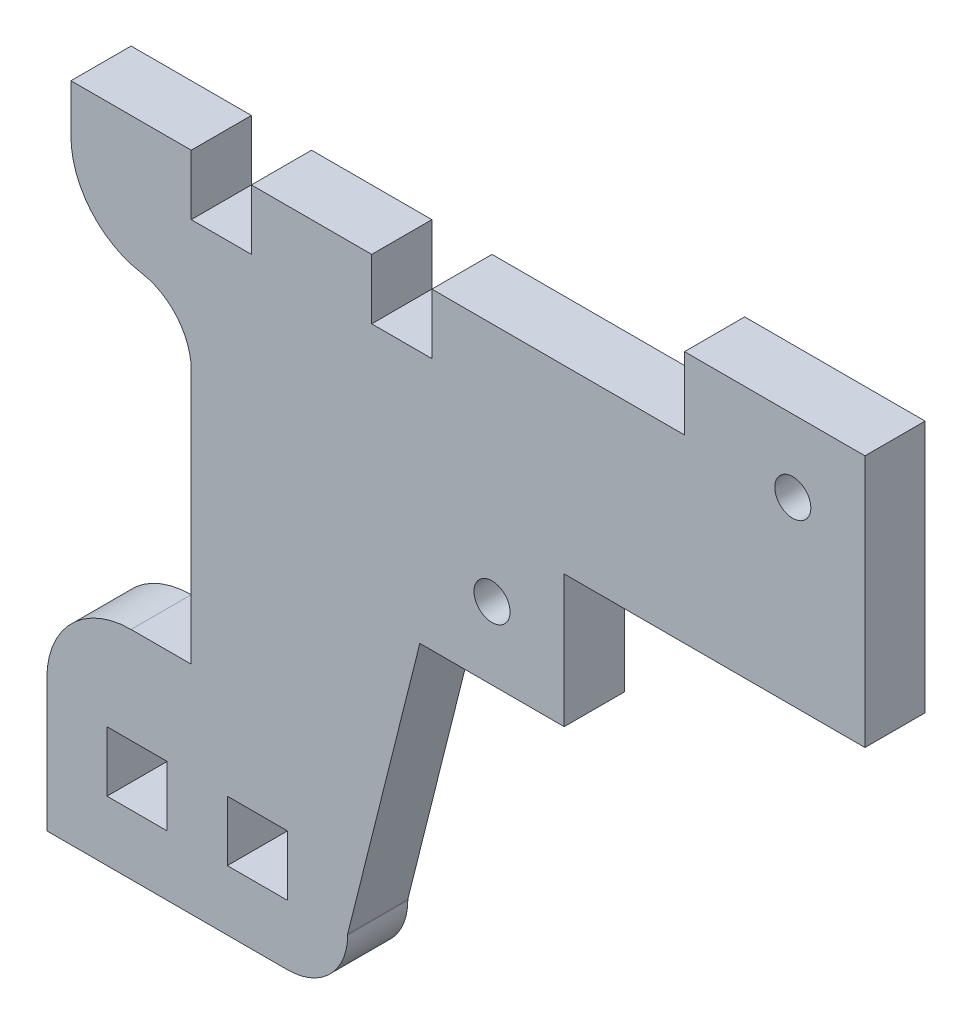
from build123d import *

# Parameters (mm, degrees)
ESQUISSE1_R        = 1.5
ESQUISSE1_W        = 5
ESQUISSE1_H        = 5
BOSS_EXTRU_1_DEPTH = 5
CONG_1_R           = 7
CONG_2_R           = 5
CONG_3_R           = 5


with BuildPart() as part:
    # Esquisse1 → Boss.-Extru.1 (new body)
    with BuildSketch(Plane.XY):
        Polygon((31, 19), (43, 19), (43, 30), (68, 30), (68, 51), (53, 51), (53, 45), (32, 45), (32, 40), (27, 40), (27, 45), (17, 45), (17, 40), (12, 40), (12, 45), (2, 45), (2, 40), (2, 34), (12, 34), (12, 8), (0, 8), (0, 0), (0, -5.810046935), (0, -10), (25, -10), (25, -4.928993292), align=None)
        with Locations((62, 45)):
            Circle(ESQUISSE1_R, mode=Mode.SUBTRACT)
        with Locations((37, 25)):
            Circle(ESQUISSE1_R, mode=Mode.SUBTRACT)
        with Locations((7.5, -2.5)):
            Rectangle(ESQUISSE1_W, ESQUISSE1_H, mode=Mode.SUBTRACT)
        with Locations((17.5, -2.5)):
            Rectangle(ESQUISSE1_W, ESQUISSE1_H, mode=Mode.SUBTRACT)
    extrude(amount=BOSS_EXTRU_1_DEPTH)

    # Congé1
    cong_1_edges = [part.edges().sort_by_distance(p)[0] for p in [
        (0, 8, 2.5),
        (2, 34, 2.5),
    ]]
    fillet(cong_1_edges, radius=CONG_1_R)

    # Congé2
    cong_2_edges = [part.edges().sort_by_distance(p)[0] for p in [
        (12, 34, 2.5),
    ]]
    fillet(cong_2_edges, radius=CONG_2_R)

    # Congé3
    cong_3_edges = [part.edges().sort_by_distance(p)[0] for p in [
        (25, -10, 2.5),
    ]]
    fillet(cong_3_edges, radius=CONG_3_R)


solid = part.part
